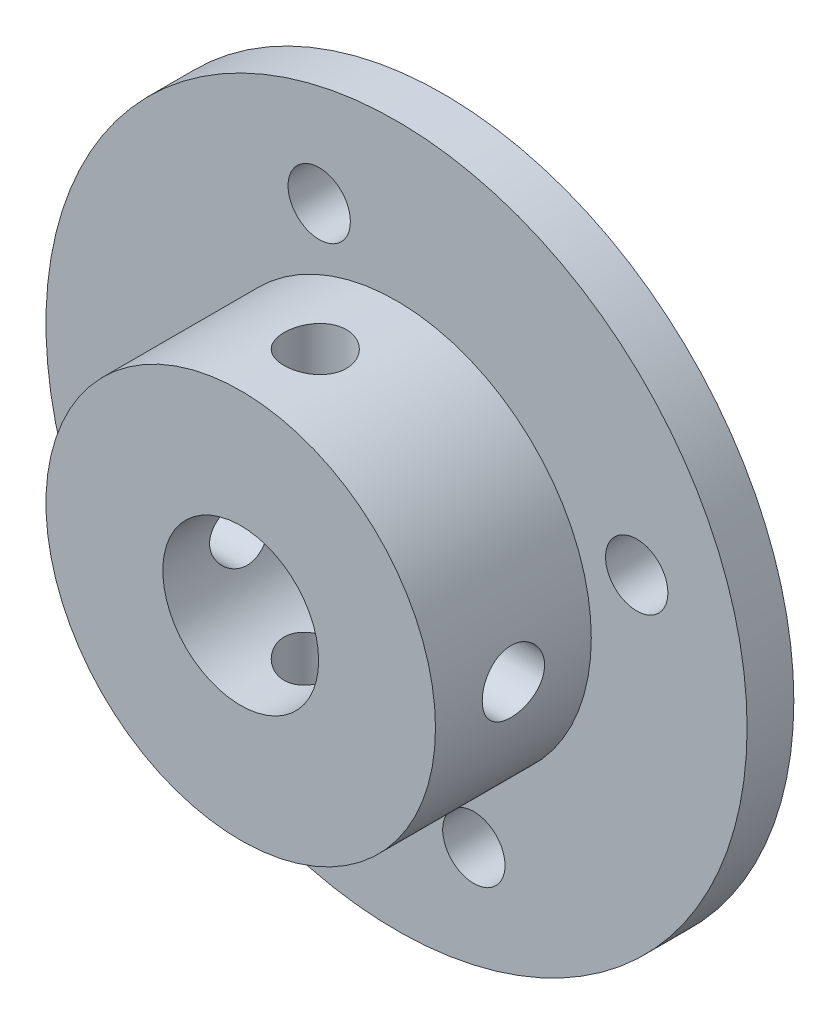
from build123d import *

# Parameters (mm, degrees)
CROQUIS1_R                 = 22.5
SALIENTE_EXTRUIR1_DEPTH    = 3
CROQUIS2_R                 = 12.5
SALIENTE_EXTRUIR2_DEPTH    = 10
CROQUIS3_R                 = 5
CORTAR_EXTRUIR1_DEPTH      = 35.372954485
CROQUIS4_R                 = 2
CORTAR_EXTRUIR2_DEPTH      = 34.35416016
CORTAR_EXTRUIR3_DEPTH      = 35.372954485
CORTAR_EXTRUIR3_DEPTH_BACK = 35.372954485
CROQUIS5_R                 = 2
CORTAR_EXTRUIR4_DEPTH      = 35.372954522
CORTAR_EXTRUIR4_DEPTH_BACK = 35.372954522
CROQUIS6_R                 = 2


with BuildPart() as part:
    # Croquis1 → Saliente-Extruir1 (new body)
    with BuildSketch(Plane.XY):
        Circle(CROQUIS1_R)
    extrude(amount=SALIENTE_EXTRUIR1_DEPTH)

    # Croquis2 → Saliente-Extruir2 (add)
    with BuildSketch(Plane.XY.offset(3)):
        Circle(CROQUIS2_R)
    extrude(amount=SALIENTE_EXTRUIR2_DEPTH)

    # Croquis3 → Cortar-Extruir1 (cut, through all)
    with BuildSketch(Plane.XY.offset(13)):
        Circle(CROQUIS3_R)
    extrude(amount=-CORTAR_EXTRUIR1_DEPTH, mode=Mode.SUBTRACT)

    # Croquis4 → Cortar-Extruir2 (cut, through all)
    with BuildSketch(Plane.XY.offset(3)):
        with Locations((-4.962538649, 15.414885677)):
            Circle(CROQUIS4_R)
        with Locations((15.414885677, 4.962538649)):
            Circle(CROQUIS4_R)
        with Locations((4.962538649, -15.414885677)):
            Circle(CROQUIS4_R)
        with Locations((-15.414885677, -4.962538649)):
            Circle(CROQUIS4_R)
    extrude(amount=-CORTAR_EXTRUIR2_DEPTH, mode=Mode.SUBTRACT)

    # Croquis5 → Cortar-Extruir3 (cut, two sides: drawn at the far end of the back side and taken through both)
    with BuildSketch(Plane(origin=(0, 0, 0), x_dir=(0, 0, -1), z_dir=(1, 0, 0)).offset(-CORTAR_EXTRUIR3_DEPTH_BACK)):
        with Locations((-8, 0)):
            Circle(CROQUIS5_R)
    extrude(amount=CORTAR_EXTRUIR3_DEPTH + CORTAR_EXTRUIR3_DEPTH_BACK, mode=Mode.SUBTRACT)

    # Croquis6 → Cortar-Extruir4 (cut, two sides: drawn at the far end of the back side and taken through both)
    with BuildSketch(Plane(origin=(0, 0, 0), x_dir=(1, 0, 0), z_dir=(0, 1, 0)).offset(-CORTAR_EXTRUIR4_DEPTH_BACK)):
        with Locations(Location((0, -8.215337569, 0), (0, 0, 270))):
            Circle(CROQUIS6_R)
    extrude(amount=CORTAR_EXTRUIR4_DEPTH + CORTAR_EXTRUIR4_DEPTH_BACK, mode=Mode.SUBTRACT)


solid = part.part
